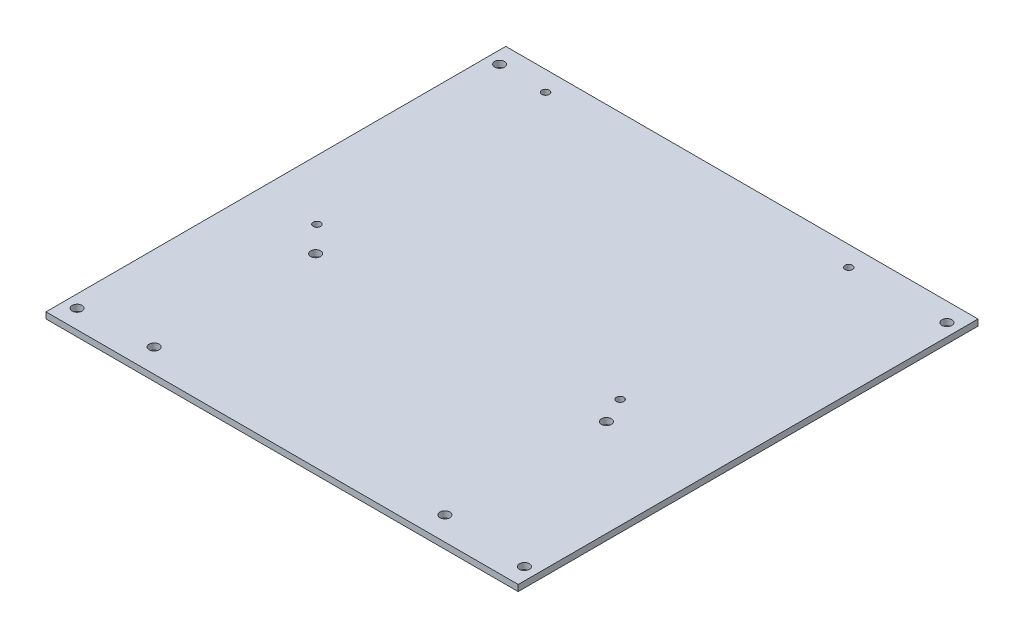
from build123d import *

# Parameters (mm, degrees)
SKETCH1_W           = 190
SKETCH1_H           = 185
BOSS_EXTRUDE1_DEPTH = 2.5
SKETCH3_R           = 2
CUT_EXTRUDE2_DEPTH  = 10
SKETCH4_R           = 2
CUT_EXTRUDE3_DEPTH  = 10
SKETCH5_R           = 1.5
CUT_EXTRUDE4_DEPTH  = 10


with BuildPart() as part:
    # Sketch1 → Boss-Extrude1 (new body)
    with BuildSketch(Plane(origin=(0, 0, 0), x_dir=(1, 0, 0), z_dir=(0, 1, 0))):
        Rectangle(SKETCH1_W, SKETCH1_H)
    extrude(amount=BOSS_EXTRUDE1_DEPTH)

    # Sketch3 → Cut-Extrude2 (cut)
    with BuildSketch(Plane(origin=(0, 2.5, 0), x_dir=(1, 0, 0), z_dir=(0, 1, 0))):
        with Locations(Location((90, 85, 0), (0, 0, 270))):
            Circle(SKETCH3_R)
        with Locations(Location((-90, 85, 0), (0, 0, 270))):
            Circle(SKETCH3_R)
        with Locations(Location((-90, -85, 0), (0, 0, 270))):
            Circle(SKETCH3_R)
        with Locations(Location((90, -85, 0), (0, 0, 270))):
            Circle(SKETCH3_R)
    extrude(amount=-CUT_EXTRUDE2_DEPTH, mode=Mode.SUBTRACT)

    # Sketch4 → Cut-Extrude3 (cut)
    with BuildSketch(Plane(origin=(0, 2.5, 0), x_dir=(1, 0, 0), z_dir=(0, 1, 0))):
        with Locations(Location((56, -83, 0), (0, 0, 270))):
            Circle(SKETCH4_R)
        with Locations(Location((-61, -83, 0), (0, 0, 270))):
            Circle(SKETCH4_R)
        with Locations(Location((-61, -18, 0), (0, 0, 270))):
            Circle(SKETCH4_R)
        with Locations(Location((56, -18, 0), (0, 0, 270))):
            Circle(SKETCH4_R)
    extrude(amount=-CUT_EXTRUDE3_DEPTH, mode=Mode.SUBTRACT)

    # Sketch5 → Cut-Extrude4 (cut)
    with BuildSketch(Plane(origin=(0, 2.5, 0), x_dir=(1, 0, 0), z_dir=(0, 1, 0))):
        with Locations(Location((-71, 84.5, 0), (0, 0, 270))):
            Circle(SKETCH5_R)
        with Locations(Location((51, 84.5, 0), (0, 0, 270))):
            Circle(SKETCH5_R)
        with Locations(Location((51, -7.5, 0), (0, 0, 270))):
            Circle(SKETCH5_R)
        with Locations(Location((-71, -7.5, 0), (0, 0, 270))):
            Circle(SKETCH5_R)
    extrude(amount=-CUT_EXTRUDE4_DEPTH, mode=Mode.SUBTRACT)


solid = part.part
